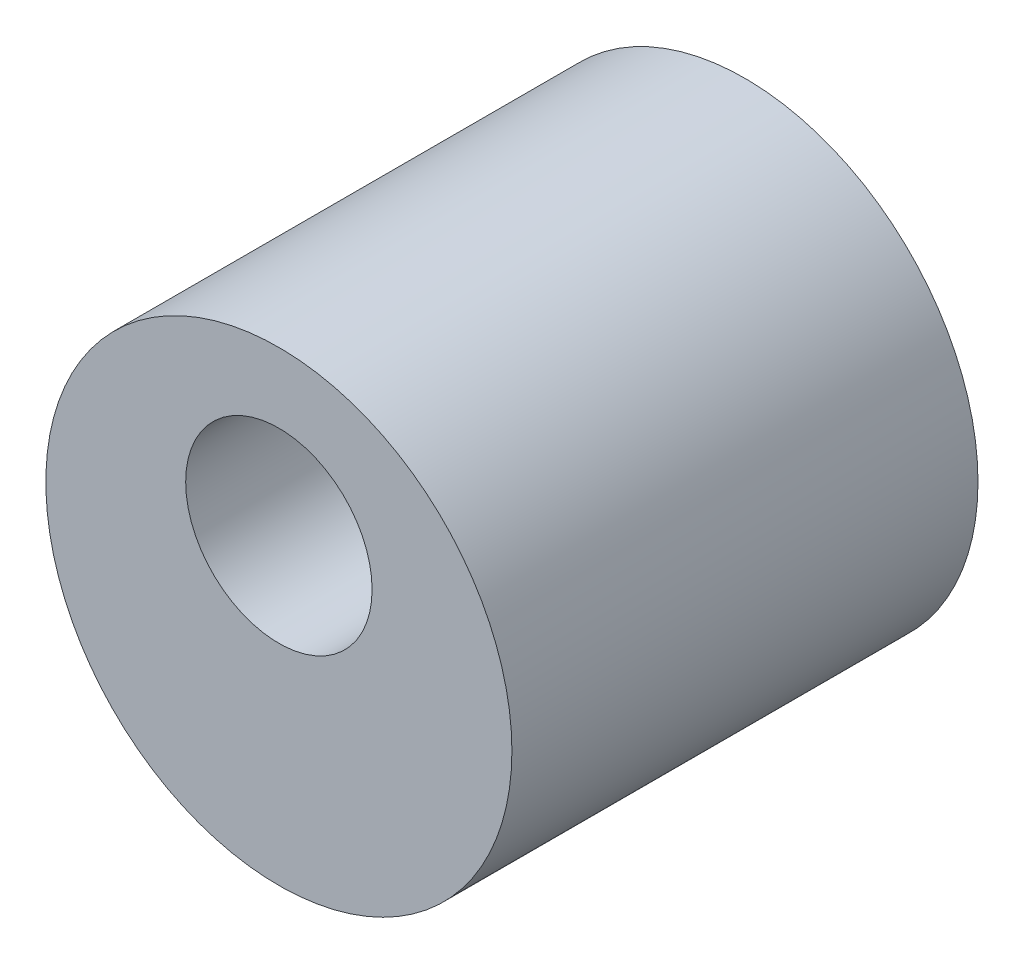
from build123d import *

# Parameters (mm, degrees)
CROQUIS1_R              = 5
SALIENTE_EXTRUIR1_DEPTH = 5
CROQUIS2_R              = 2
CORTAR_EXTRUIR1_DEPTH   = 13.247448714


with BuildPart() as part:
    # Croquis1 → Saliente-Extruir1 (new, symmetric)
    with BuildSketch(Plane.XY):
        Circle(CROQUIS1_R)
    extrude(amount=SALIENTE_EXTRUIR1_DEPTH, both=True)

    # Croquis2 → Cortar-Extruir1 (cut, through all)
    with BuildSketch(Plane.XY.offset(5)):
        with Locations((0, 1.5)):
            Circle(CROQUIS2_R)
    extrude(amount=-CORTAR_EXTRUIR1_DEPTH, mode=Mode.SUBTRACT)


solid = part.part
